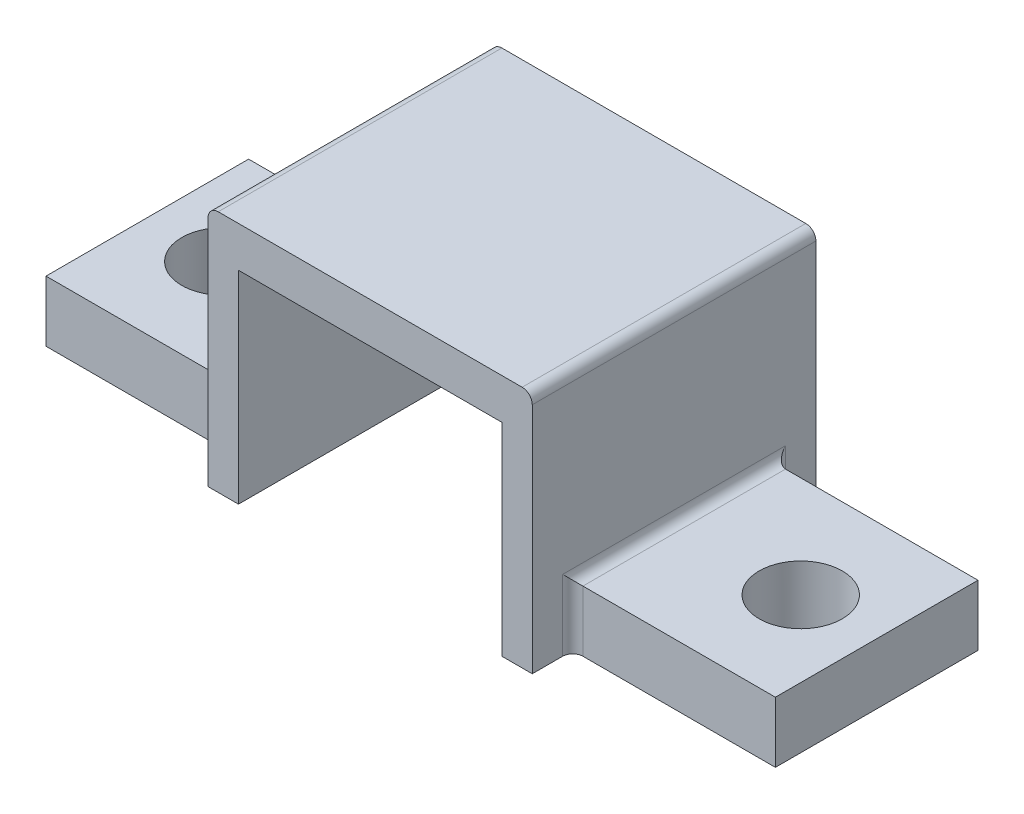
from build123d import *

# Parameters (mm, degrees)
SKETCH1_W               = 16
SKETCH1_H               = 12
BOSS_EXTRUDE1_DEPTH     = 7
SKETCH2_W               = 13
SKETCH2_H               = 10
CUT_EXTRUDE1_DEPTH      = 18.204650534
SKETCH6_W               = 10
SKETCH6_H               = 10
BOSS_EXTRUDE2_DEPTH     = 3
FILLET1_R               = 0.5
CUT_EXTRUDE2_DEPTH      = 22.307275753
CUT_EXTRUDE2_DEPTH_BACK = 10
SKETCH9_R               = 2.05


with BuildPart() as part:
    # Sketch1 → Boss-Extrude1 (new, symmetric)
    with BuildSketch(Plane.XY):
        Rectangle(SKETCH1_W, SKETCH1_H)
    extrude(amount=BOSS_EXTRUDE1_DEPTH, both=True)

    # Sketch2 → Cut-Extrude1 (cut, through all)
    with BuildSketch(Plane.XY.offset(7)):
        with Locations((0, -1)):
            Rectangle(SKETCH2_W, SKETCH2_H)
    extrude(amount=-CUT_EXTRUDE1_DEPTH, mode=Mode.SUBTRACT)

    # Sketch6 → Boss-Extrude2 (add)
    with BuildSketch(Plane.XZ.offset(6)):
        with Locations((-13, 0)):
            Rectangle(SKETCH6_W, SKETCH6_H)
        with Locations((13, 0)):
            Rectangle(SKETCH6_W, SKETCH6_H)
    extrude(amount=-BOSS_EXTRUDE2_DEPTH)

    # Fillet1
    fillet1_edges = [part.edges().sort_by_distance(p)[0] for p in [
        (8, 6, 0),
        (-8, 6, 0),
        (-8, -3, 0),
        (8, -3, 0),
        (8, -4.5, 5),
        (8, -4.5, -5),
        (-8, -4.5, -5),
        (-8, -4.5, 5),
    ]]
    fillet(fillet1_edges, radius=FILLET1_R)

    # Sketch9 → Cut-Extrude2 (cut, two sides: drawn at the far end of the back side and taken through both)
    with BuildSketch(Plane(origin=(0, -3, 0), x_dir=(1, 0, 0), z_dir=(0, 1, 0)).offset(-CUT_EXTRUDE2_DEPTH_BACK)):
        with Locations((-14.25, 0)):
            Circle(SKETCH9_R)
        with Locations((14.25, 0)):
            Circle(SKETCH9_R)
    extrude(amount=CUT_EXTRUDE2_DEPTH + CUT_EXTRUDE2_DEPTH_BACK, mode=Mode.SUBTRACT)


solid = part.part
